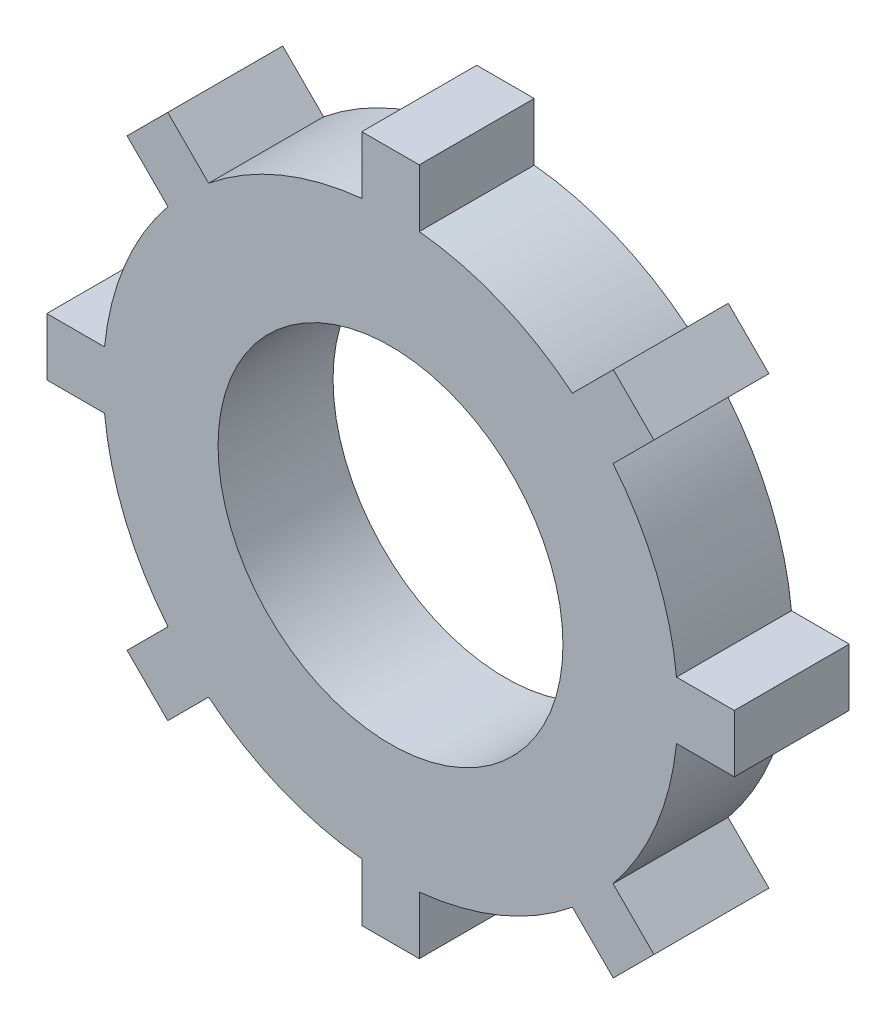
from build123d import *

# Parameters (mm, degrees)
SKETCH1_R           = 15
BOSS_EXTRUDE1_DEPTH = 10


with BuildPart() as part:
    # Sketch1 → Boss-Extrude1 (new body)
    with BuildSketch(Plane.XY):
        with BuildLine():
            Line((22.913573162, 19.378039256), (19.356826052, 15.821292146))
            ThreePointArc((19.356826052, 15.821292146), (23.096988313, 9.567085809), (24.874685928, 2.5))
            Line((24.874685928, 2.5), (29.9, 2.5))
            Line((29.9, 2.5), (29.9, -2.5))
            Line((29.9, -2.5), (24.874685928, -2.5))
            ThreePointArc((24.874685928, -2.5), (23.096988313, -9.567085809), (19.356826052, -15.821292146))
            Line((19.356826052, -15.821292146), (22.913573162, -19.378039256))
            Line((22.913573162, -19.378039256), (19.378039256, -22.913573162))
            Line((19.378039256, -22.913573162), (15.821292146, -19.356826052))
            ThreePointArc((15.821292146, -19.356826052), (9.567085809, -23.096988313), (2.5, -24.874685928))
            Line((2.5, -24.874685928), (2.5, -29.9))
            Line((2.5, -29.9), (-2.5, -29.9))
            Line((-2.5, -29.9), (-2.5, -24.874685928))
            ThreePointArc((-2.5, -24.874685928), (-9.567085809, -23.096988313), (-15.821292146, -19.356826052))
            Line((-15.821292146, -19.356826052), (-19.378039256, -22.913573162))
            Line((-19.378039256, -22.913573162), (-22.913573162, -19.378039256))
            Line((-22.913573162, -19.378039256), (-19.356826052, -15.821292146))
            ThreePointArc((-19.356826052, -15.821292146), (-23.096988313, -9.567085809), (-24.874685928, -2.5))
            Line((-24.874685928, -2.5), (-29.9, -2.5))
            Line((-29.9, -2.5), (-29.9, 2.5))
            Line((-29.9, 2.5), (-24.874685928, 2.5))
            ThreePointArc((-24.874685928, 2.5), (-23.096988313, 9.567085809), (-19.356826052, 15.821292146))
            Line((-19.356826052, 15.821292146), (-22.913573162, 19.378039256))
            Line((-22.913573162, 19.378039256), (-19.378039256, 22.913573162))
            Line((-19.378039256, 22.913573162), (-15.821292146, 19.356826052))
            ThreePointArc((-15.821292146, 19.356826052), (-9.567085809, 23.096988313), (-2.5, 24.874685928))
            Line((-2.5, 24.874685928), (-2.5, 29.9))
            Line((-2.5, 29.9), (2.5, 29.9))
            Line((2.5, 29.9), (2.5, 24.874685928))
            ThreePointArc((2.5, 24.874685928), (9.567085809, 23.096988313), (15.821292146, 19.356826052))
            Line((15.821292146, 19.356826052), (19.378039256, 22.913573162))
            Line((19.378039256, 22.913573162), (22.913573162, 19.378039256))
        make_face()
        Circle(SKETCH1_R, mode=Mode.SUBTRACT)
    extrude(amount=BOSS_EXTRUDE1_DEPTH)


solid = part.part
